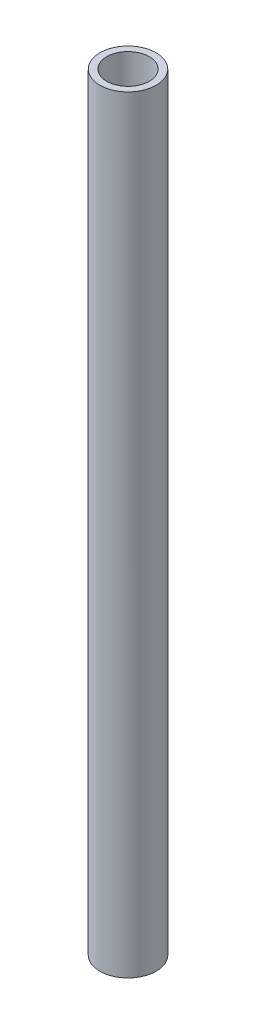
from build123d import *

# Parameters (mm, degrees)
SKETCH1_R           = 8.382
SKETCH1_R_2         = 6.35
BOSS_EXTRUDE1_DEPTH = 228.6
CUT_EXTRUDE1_DEPTH  = 228.6


with BuildPart() as part:
    # Sketch1 → Boss-Extrude1 (new body)
    with BuildSketch(Plane(origin=(0, 0, 0), x_dir=(1, 0, 0), z_dir=(0, 1, 0))):
        with Locations(Location((0, 0, 0), (0, 0, 270))):
            Circle(SKETCH1_R)
        with Locations(Location((0, 0, 0), (0, 0, 270))):
            Circle(SKETCH1_R_2, mode=Mode.SUBTRACT)
    extrude(amount=BOSS_EXTRUDE1_DEPTH)

    # Sketch3 → Cut-Extrude1 (cut)
    with BuildSketch(Plane(origin=(0, 0, 0), x_dir=(0, 0, -1), z_dir=(1, 0, 0))):
        with BuildLine():
            Line((-2.417681697, -8.09513592), (-2.417681697, 43.280600145))
            ThreePointArc((-2.417681697, 43.280600145), (0, 45.698281842), (2.417681697, 43.280600145))
            Line((2.417681697, 43.280600145), (2.417681697, -8.09513592))
            ThreePointArc((2.417681697, -8.09513592), (0, -10.512817617), (-2.417681697, -8.09513592))
        make_face()
    extrude(amount=-CUT_EXTRUDE1_DEPTH, mode=Mode.SUBTRACT)


solid = part.part
